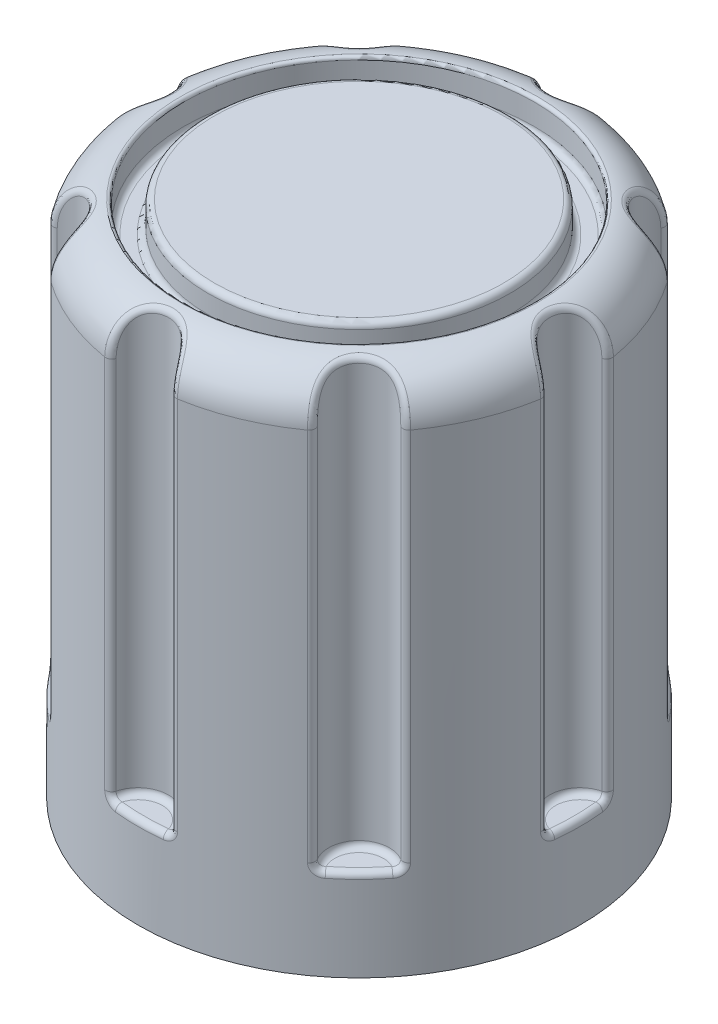
from build123d import *

# Parameters (mm, degrees)
ESBO_O1_R                = 7.25
RESSALTO_EXTRUS_O1_DEPTH = 17
FILETE1_R                = 1.5
ESBO_O2_R                = 1
CORTE_EXTRUS_O1_DEPTH    = 14
ESBO_O3_R                = 5.75
ESBO_O3_R_2              = 4.95
CORTE_EXTRUS_O2_DEPTH    = 1
FILETE2_R                = 0.2
FILETE3_R                = 0.2
FILETE4_R                = 0.1
ESBO_O4_R                = 3.1
CORTE_EXTRUS_O3_DEPTH    = 14
FILETE5_R                = 3
FILETE7_R                = 0.2


with BuildPart() as part:
    # Esboço1 → Ressalto-extrusão1 (new body)
    with BuildSketch(Plane(origin=(0, 0, 0), x_dir=(1, 0, 0), z_dir=(0, 1, 0))):
        with Locations(Location((0, 0, 0), (0, 0, 270))):
            Circle(ESBO_O1_R)
    extrude(amount=RESSALTO_EXTRUS_O1_DEPTH)

    # Filete1
    filete1_edges = [part.edges().sort_by_distance(p)[0] for p in [
        (0, 17, -7.25),
    ]]
    fillet(filete1_edges, radius=FILETE1_R)

    # Esboço2 → Corte-extrusão1 (cut)
    with BuildSketch(Plane(origin=(0, 17, 0), x_dir=(1, 0, 0), z_dir=(0, 1, 0))):
        with Locations((0, 7.25)):
            Circle(ESBO_O2_R)
        with Locations((5.126524164, 5.126524164)):
            Circle(ESBO_O2_R)
        with Locations((7.25, 0)):
            Circle(ESBO_O2_R)
        with Locations((5.126524164, -5.126524164)):
            Circle(ESBO_O2_R)
        with Locations((0, -7.25)):
            Circle(ESBO_O2_R)
        with Locations((-5.126524164, -5.126524164)):
            Circle(ESBO_O2_R)
        with Locations((-7.25, 0)):
            Circle(ESBO_O2_R)
        with Locations((-5.126524164, 5.126524164)):
            Circle(ESBO_O2_R)
    extrude(amount=-CORTE_EXTRUS_O1_DEPTH, mode=Mode.SUBTRACT)

    # Esboço3 → Corte-extrusão2 (cut)
    with BuildSketch(Plane(origin=(0, 17, 0), x_dir=(1, 0, 0), z_dir=(0, 1, 0))):
        with Locations(Location((0, 0, 0), (0, 0, 270))):
            Circle(ESBO_O3_R)
        with Locations(Location((0, 0, 0), (0, 0, 270))):
            Circle(ESBO_O3_R_2, mode=Mode.SUBTRACT)
    extrude(amount=-CORTE_EXTRUS_O2_DEPTH, mode=Mode.SUBTRACT)

    # Filete2
    filete2_edges = [part.edges().sort_by_distance(p)[0] for p in [
        (0, 16, -5.75),
        (0, 16, -4.95),
    ]]
    fillet(filete2_edges, radius=FILETE2_R)

    # Filete3
    filete3_edges = [part.edges().sort_by_distance(p)[0] for p in [
        (0, 17, -4.95),
    ]]
    fillet(filete3_edges, radius=FILETE3_R)

    # Filete4
    filete4_edges = [part.edges().sort_by_distance(p)[0] for p in [
        (0, 17, -5.75),
    ]]
    fillet(filete4_edges, radius=FILETE4_R)

    # Esboço4 → Corte-extrusão3 (cut)
    with BuildSketch(Plane.XZ):
        with Locations(Location((0, 0, 0), (0, 0, 270))):
            Circle(ESBO_O4_R)
    extrude(amount=-CORTE_EXTRUS_O3_DEPTH, mode=Mode.SUBTRACT)

    # Filete5
    filete5_edges = [part.edges().sort_by_distance(p)[0] for p in [
        (0, 14, 3.1),
    ]]
    fillet(filete5_edges, radius=FILETE5_R)

    # Filete7
    filete7_edges = [part.edges().sort_by_distance(p)[0] for p in [
        (-5.077911931, 16.772658383, -4.127706437),
        (-6.25, 16.914213562, 0),
        (-4.419417383, 16.914213562, 4.419417382),
        (0.877026658, 16.544957999, 6.76955829),
        (4.419417383, 16.914213562, 4.419417382),
        (6.25, 16.914213562, 0),
        (4.419417382, 16.914213562, -4.419417383),
        (0, 16.914213562, -6.25),
        (-5.126524164, 3, -5.126524164),
        (-7.25, 3, 0),
        (-5.126524164, 3, 5.126524164),
        (0.5, 3, 7.232738071),
        (5.126524164, 3, 5.126524164),
        (7.25, 3, 0),
        (5.126524164, 3, -5.126524164),
        (0, 3, -7.25),
        (0, 3, -6.25),
        (0.997619044, 9.25, -7.181034483),
        (-0.997619044, 9.25, -7.181034483),
        (4.419417382, 3, -4.419417382),
        (5.78318137, 9.25, -4.372334987),
        (4.372334987, 9.25, -5.78318137),
        (6.25, 3, 0),
        (7.181034483, 9.25, 0.997619044),
        (7.181034483, 9.25, -0.997619044),
        (4.419417382, 3, 4.419417382),
        (4.372334987, 9.25, 5.78318137),
        (5.78318137, 9.25, 4.372334987),
        (0, 3, 6.25),
        (-0.997619044, 9.25, 7.181034483),
        (0.997619044, 9.25, 7.181034483),
        (-4.419417382, 3, 4.419417382),
        (-5.78318137, 9.25, 4.372334987),
        (-4.372334987, 9.25, 5.78318137),
        (-6.25, 3, 0),
        (-7.181034483, 9.25, -0.997619044),
        (-7.181034483, 9.25, 0.997619044),
        (-4.419417382, 3, -4.419417382),
        (-4.372334987, 9.25, -5.78318137),
        (-5.78318137, 9.25, -4.372334987),
    ]]
    fillet(filete7_edges, radius=FILETE7_R)


solid = part.part
